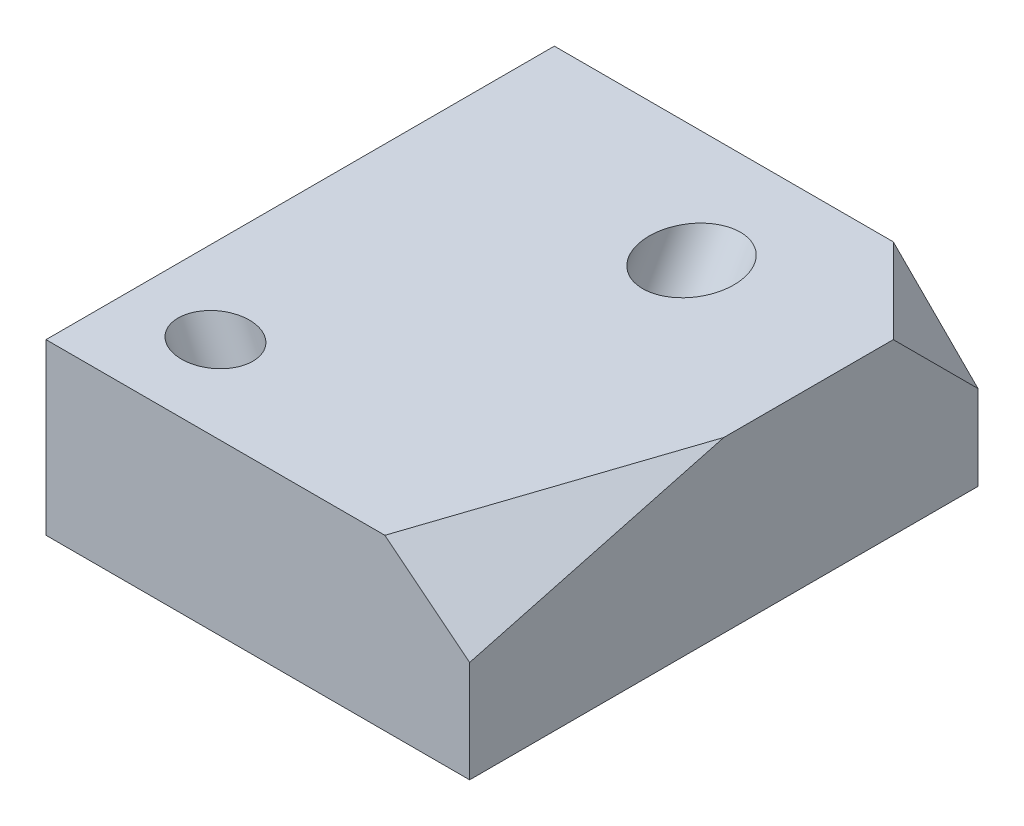
from build123d import *

# Parameters (mm, degrees)
SKETCH1_W           = 127
SKETCH1_H           = 152.4
BOSS_EXTRUDE1_DEPTH = 50.8
CUT_EXTRUDE1_DEPTH  = 156.939365922
CUT_EXTRUDE2_DEPTH  = 186.205309499
SKETCH6_R           = 10.16
CUT_EXTRUDE3_DEPTH  = 139.062227017
SKETCH7_R           = 12.7
CUT_EXTRUDE4_DEPTH  = 152.108237347


with BuildPart() as part:
    # Sketch1 → Boss-Extrude1 (new body)
    with BuildSketch(Plane(origin=(0, 0, 0), x_dir=(1, 0, 0), z_dir=(0, 1, 0))):
        Rectangle(SKETCH1_W, SKETCH1_H)
    extrude(amount=BOSS_EXTRUDE1_DEPTH)

    # Sketch3 → Cut-Extrude1 (cut, through all)
    with BuildSketch(Plane(origin=(47.501298701, 59.376623377, 15.833766234), x_dir=(0.7911852033335974, -0.5909267078840147, -0.1575804554357373), z_dir=(0.6115766297251508, 0.7644707871564383, 0.20385887657505028))):
        Polygon((-11.882551218, -60.537839749), (20.221183651, 13.089262648), (20.221183651, -65.773544809), align=None)
    extrude(amount=CUT_EXTRUDE1_DEPTH, mode=Mode.SUBTRACT)

    # Sketch4 → Cut-Extrude2 (cut, through all)
    with BuildSketch(Plane(origin=(55.033333333, 55.033333333, -55.033333333), x_dir=(0.816496580927726, -0.40824829046386363, 0.40824829046386246), z_dir=(0.5773502691896258, 0.577350269189627, -0.5773502691896246))):
        Polygon((-20.739013156, 17.960512242), (10.369506578, 35.921024484), (10.369506578, 0), align=None)
    extrude(amount=CUT_EXTRUDE2_DEPTH, mode=Mode.SUBTRACT)

    # Sketch6 → Cut-Extrude3 (cut, through all)
    with BuildSketch(Plane(origin=(-30.799022248, 66.048716355, 0), x_dir=(0, 0, 1), z_dir=(-0.4226182617407003, 0.9063077870366496, 0))):
        with Locations(Location((50.8, -13.06131899, 0), (0, 0, 270))):
            Circle(SKETCH6_R)
    extrude(amount=-CUT_EXTRUDE3_DEPTH, mode=Mode.SUBTRACT)

    # Sketch7 → Cut-Extrude4 (cut, through all)
    with BuildSketch(Plane(origin=(0, 71.095567884, -41.047045256), x_dir=(-1, 0, 0), z_dir=(0, 0.866025403784438, -0.500000000000001))):
        with Locations(Location((-12.7, -10.208864232, 0), (0, 0, 270))):
            Circle(SKETCH7_R)
    extrude(amount=-CUT_EXTRUDE4_DEPTH, mode=Mode.SUBTRACT)


solid = part.part
